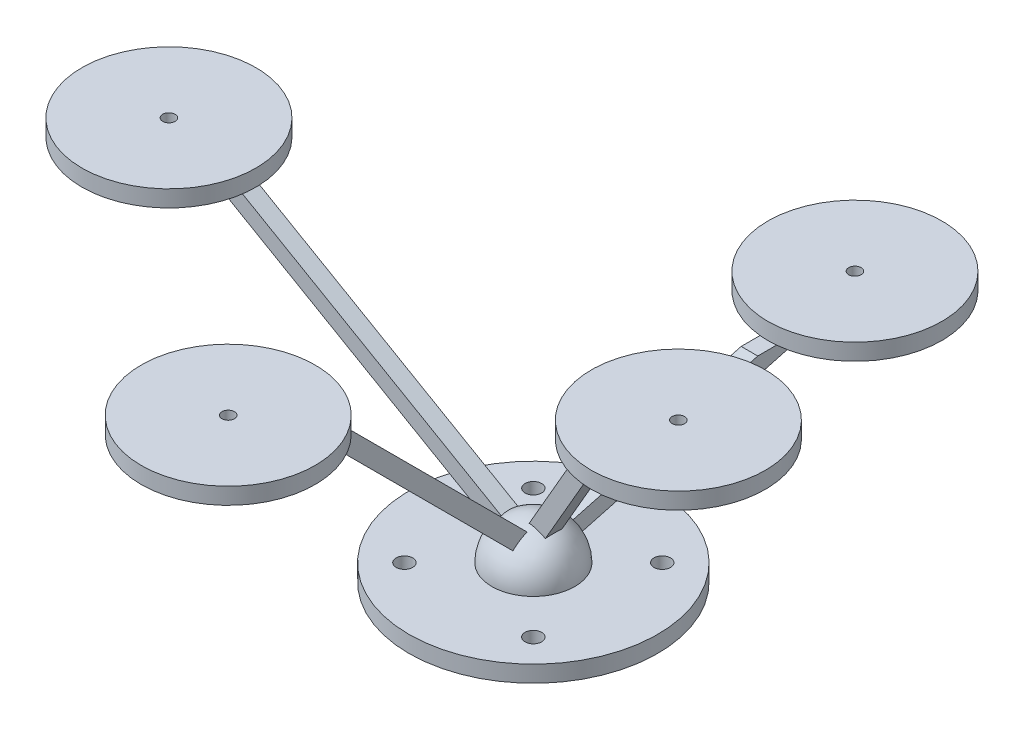
from build123d import *

# Parameters (mm, degrees)
SKETCH_1_R      = 15
SKETCH_1_R_2    = 1
EXTRUDE_1_DEPTH = 2
EXTRUDE_2_DEPTH = 1
SKETCH_4_R      = 10.5
SKETCH_4_R_2    = 0.75
EXTRUDE_3_DEPTH = 2
SKETCH_5_R      = 10.5
SKETCH_5_R_2    = 0.75
EXTRUDE_4_DEPTH = 2
EXTRUDE_5_DEPTH = 1
SKETCH_7_R      = 10.5
SKETCH_7_R_2    = 0.75
EXTRUDE_6_DEPTH = 2
SKETCH_8_R      = 10.5
SKETCH_8_R_2    = 0.75
EXTRUDE_7_DEPTH = 2


with BuildPart() as part:
    # 草图1 → 凸台-拉伸1 (new body)
    with BuildSketch(Plane(origin=(0, 0, 0), x_dir=(1, 0, 0), z_dir=(0, 1, 0))):
        with Locations(Location((0, 0, 0), (0, 0, 270))):
            Circle(SKETCH_1_R)
        with Locations(Location((7.778174593, 7.778174593, 0), (0, 0, 270))):
            Circle(SKETCH_1_R_2, mode=Mode.SUBTRACT)
        with Locations(Location((-7.778174593, 7.778174593, 0), (0, 0, 270))):
            Circle(SKETCH_1_R_2, mode=Mode.SUBTRACT)
        with Locations(Location((-7.778174593, -7.778174593, 0), (0, 0, 270))):
            Circle(SKETCH_1_R_2, mode=Mode.SUBTRACT)
        with Locations(Location((7.778174593, -7.778174593, 0), (0, 0, 270))):
            Circle(SKETCH_1_R_2, mode=Mode.SUBTRACT)
    extrude(amount=EXTRUDE_1_DEPTH)

    # 草图2 → 旋转1 (revolve)
    with BuildSketch(Plane(origin=(0, 0, 0), x_dir=(0, 0, -1), z_dir=(1, 0, 0))):
        with BuildLine():
            Line((0, 2), (0, 7))
            ThreePointArc((0, 7), (3.535533906, 5.535533906), (5, 2))
            Line((5, 2), (0, 2))
        make_face()
    revolve(axis=Axis((0, 2, 0), (0, 1, 0)))

    # 草图3 → 凸台-拉伸2 (add, symmetric)
    with BuildSketch(Plane.XY):
        Polygon((0, 2), (12.5, 23.650635095), (10.190598923, 23.650635095), (0, 6), (0, 4.309401077), (-34.97114317, 24.5), (-38.97114317, 24.5), align=None)
    extrude(amount=EXTRUDE_2_DEPTH, both=True)

    # 草图4 → 凸台-拉伸3 (add)
    with BuildSketch(Plane(origin=(0, 23.650635095, 0), x_dir=(1, 0, 0), z_dir=(0, 1, 0))):
        with Locations(Location((17.5, 0, 0), (0, 0, 270))):
            Circle(SKETCH_4_R)
        with Locations(Location((17.5, 0, 0), (0, 0, 270))):
            Circle(SKETCH_4_R_2, mode=Mode.SUBTRACT)
    extrude(amount=EXTRUDE_3_DEPTH)

    # 草图5 → 凸台-拉伸4 (add)
    with BuildSketch(Plane(origin=(0, 24.5, 0), x_dir=(1, 0, 0), z_dir=(0, 1, 0))):
        with Locations(Location((-43.97114317, 0, 0), (0, 0, 270))):
            Circle(SKETCH_5_R)
        with Locations(Location((-43.97114317, 0, 0), (0, 0, 270))):
            Circle(SKETCH_5_R_2, mode=Mode.SUBTRACT)
    extrude(amount=EXTRUDE_4_DEPTH)

    # 草图6 → 凸台-拉伸5 (add, symmetric)
    with BuildSketch(Plane(origin=(0, 0, 0), x_dir=(0, 0, -1), z_dir=(1, 0, 0))):
        Polygon((0, 2), (33.80740392, 11.058666579), (26.07999731, 11.058666579), (0, 4.070552361), (0, 4.828427125), (-28.991378029, 33.819805153), (-31.819805153, 33.819805153), align=None)
    extrude(amount=EXTRUDE_5_DEPTH, both=True)

    # 草图7 → 凸台-拉伸6 (add)
    with BuildSketch(Plane(origin=(0, 11.058666579, 0), x_dir=(1, 0, 0), z_dir=(0, 1, 0))):
        with Locations(Location((0, 38.80740392, 0), (0, 0, 264.5349762))):
            Circle(SKETCH_7_R)
        with Locations(Location((0, 38.80740392, 0), (0, 0, 270))):
            Circle(SKETCH_7_R_2, mode=Mode.SUBTRACT)
    extrude(amount=EXTRUDE_6_DEPTH)

    # 草图8 → 凸台-拉伸7 (add)
    with BuildSketch(Plane(origin=(0, 33.819805153, 0), x_dir=(1, 0, 0), z_dir=(0, 1, 0))):
        with Locations(Location((0, -36.819805153, 0), (0, 0, 270))):
            Circle(SKETCH_8_R)
        with Locations(Location((0, -36.819805153, 0), (0, 0, 270))):
            Circle(SKETCH_8_R_2, mode=Mode.SUBTRACT)
    extrude(amount=EXTRUDE_7_DEPTH)


solid = part.part
